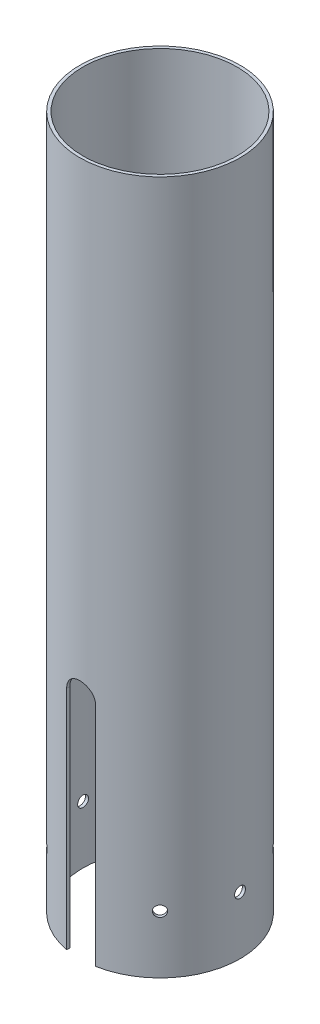
from build123d import *

# Parameters (mm, degrees)
SKETCH1_R           = 52.832
SKETCH1_R_2         = 50.8
BOSS_EXTRUDE1_DEPTH = 457.2
CUT_EXTRUDE1_DEPTH  = 464.264805967
CIRPATTERN1_COUNT   = 8


with BuildPart() as part:
    # Sketch1 → Boss-Extrude1 (new body)
    with BuildSketch(Plane(origin=(0, 0, 0), x_dir=(1, 0, 0), z_dir=(0, 1, 0))):
        with Locations(Location((0, 0, 0), (0, 0, 270))):
            Circle(SKETCH1_R)
        with Locations(Location((0, 0, 0), (0, 0, 270))):
            Circle(SKETCH1_R_2, mode=Mode.SUBTRACT)
    extrude(amount=BOSS_EXTRUDE1_DEPTH)

    # Sketch2 → Cut-Extrude1 (cut, through all)
    with BuildSketch(Plane.XY):
        with BuildLine():
            Line((-9.525, 149.225), (-9.525, 0))
            Line((-9.525, 0), (9.525, 0))
            Line((9.525, 0), (9.525, 149.225))
            ThreePointArc((9.525, 149.225), (0, 158.75), (-9.525, 149.225))
        make_face()
    extrude(amount=CUT_EXTRUDE1_DEPTH, mode=Mode.SUBTRACT)

    # Sketch4 → 1/4 Clearance Hole1 (revolve, cut)
    with BuildSketch(Plane(origin=(0, 38.1, -52.832), x_dir=(0, 1, 0), z_dir=(1, 0, 0))):
        Polygon((0, 0), (0, 12.813817477), (3.57124, 10.668), (3.57124, 0), align=None)
    f_1_4_clearance_hole1 = revolve(axis=Axis((0, 38.1, -59.182), (0, 0, 1)), mode=Mode.SUBTRACT)

    # CirPattern1: 1/4 Clearance Hole1 ×8 about axis, 1 skipped
    cirpattern1_axis = Axis((0, 457.2, 0), (0, -1, 0))
    add([f_1_4_clearance_hole1.rotate(cirpattern1_axis, i * 360 / CIRPATTERN1_COUNT) for i in range(1, CIRPATTERN1_COUNT) if i not in (4,)], mode=Mode.SUBTRACT)


solid = part.part
